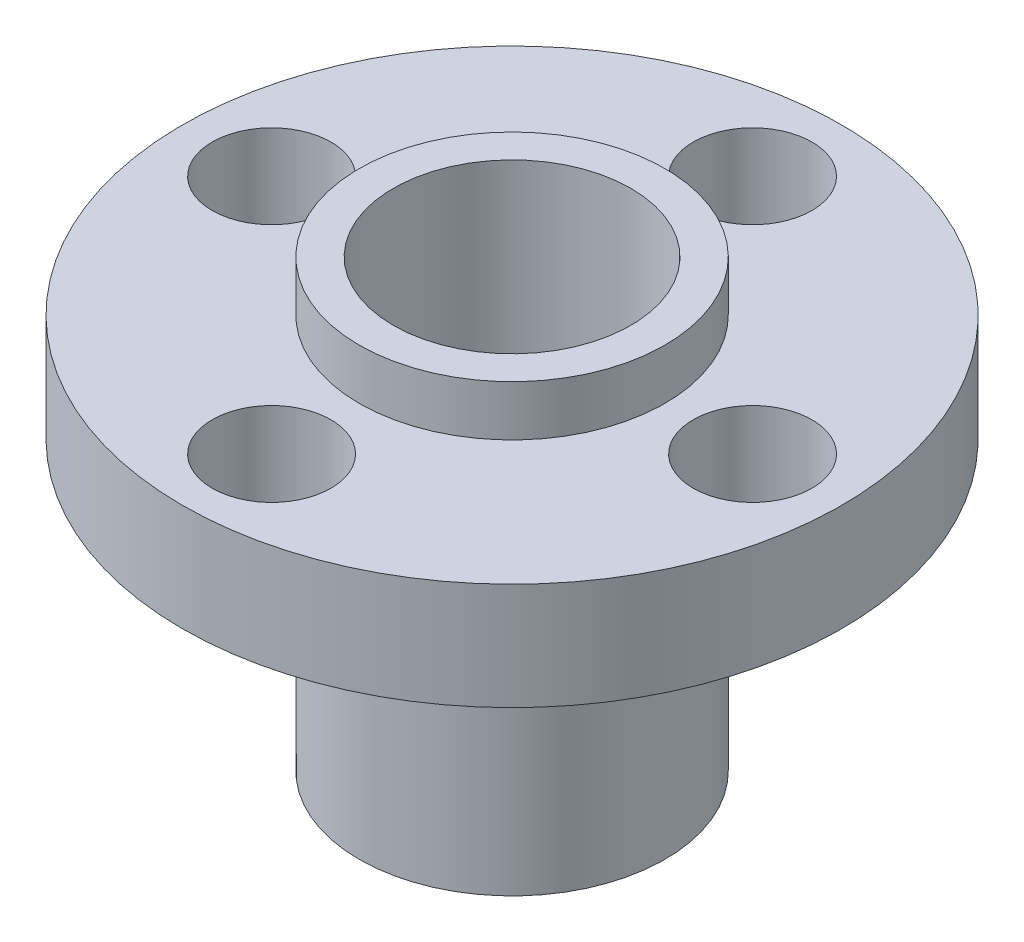
from build123d import *

# Parameters (mm, degrees)
SKETCH1_R                = 11.1
BOSS_EXTRUDE1_DEPTH      = 3.6
BOSS_EXTRUDE2_DEPTH      = 1.7
BOSS_EXTRUDE2_DEPTH_BACK = 13.3
SKETCH2_R                = 5.15
SKETCH3_R                = 4
SKETCH3_R_2              = 2
CUT_EXTRUDE1_DEPTH       = 22.712208547


with BuildPart() as part:
    # Sketch1 → Boss-Extrude1 (new body)
    with BuildSketch(Plane(origin=(0, 0, 0), x_dir=(1, 0, 0), z_dir=(0, 1, 0))):
        with Locations(Location((0, 0, 0), (0, 0, 270))):
            Circle(SKETCH1_R)
    extrude(amount=BOSS_EXTRUDE1_DEPTH)

    # Sketch2 → Boss-Extrude2 (add, two sides: drawn at the far end of the back side and taken through both)
    with BuildSketch(Plane(origin=(0, 3.6, 0), x_dir=(1, 0, 0), z_dir=(0, 1, 0)).offset(-BOSS_EXTRUDE2_DEPTH_BACK)):
        with Locations(Location((0, 0, 0), (0, 0, 270))):
            Circle(SKETCH2_R)
    extrude(amount=BOSS_EXTRUDE2_DEPTH + BOSS_EXTRUDE2_DEPTH_BACK)

    # Sketch3 → Cut-Extrude1 (cut, through all)
    with BuildSketch(Plane(origin=(0, 5.3, 0), x_dir=(1, 0, 0), z_dir=(0, 1, 0))):
        with Locations(Location((0, 0, 0), (0, 0, 270))):
            Circle(SKETCH3_R)
        with Locations(Location((-8.1, 0, 0), (0, 0, 270))):
            Circle(SKETCH3_R_2)
        with Locations(Location((8.1, 0, 0), (0, 0, 270))):
            Circle(SKETCH3_R_2)
        with Locations(Location((0, 8.1, 0), (0, 0, 270))):
            Circle(SKETCH3_R_2)
        with Locations(Location((0, -8.1, 0), (0, 0, 270))):
            Circle(SKETCH3_R_2)
    extrude(amount=-CUT_EXTRUDE1_DEPTH, mode=Mode.SUBTRACT)


solid = part.part
